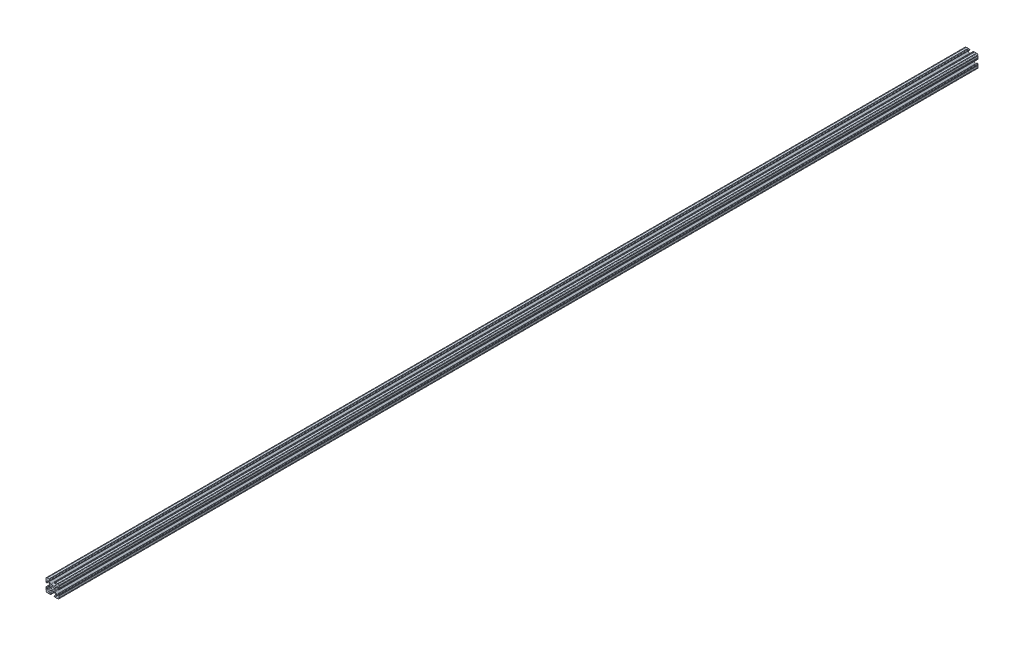
from build123d import *

# Parameters (mm, degrees)
BOSS_EXTRUDE1_DEPTH     = 1524
CUT_EXTRUDE1_DEPTH      = 1525.105829659
CUT_EXTRUDE1_DEPTH_BACK = 1525.105829659
SKETCH5_R               = 0.55245
CUT_EXTRUDE2_DEPTH      = 1525.105829659
CUT_EXTRUDE2_DEPTH_BACK = 1525.105829659
SKETCH8_W               = 50.559993734
SKETCH8_H               = 1282.7


with BuildPart() as part:
    # Sketch4 → Boss-Extrude1 (new, symmetric)
    with BuildSketch(Plane.XY):
        with BuildLine():
            Line((4.190365, -12.7), (10.11729625, -12.7))
            ThreePointArc((10.11729625, -12.7), (11.943543585, -11.943543585), (12.7, -10.11729625))
            Line((12.7, -10.11729625), (12.7, -4.190365))
            ThreePointArc((12.7, -4.190365), (12.42492494, -3.52627506), (11.760835, -3.2512))
            Line((11.760835, -3.2512), (11.429365, -3.2512))
            ThreePointArc((11.429365, -3.2512), (10.76527506, -3.52627506), (10.4902, -4.190365))
            Line((10.4902, -4.190365), (10.4902, -6.348478019))
            ThreePointArc((10.4902, -6.348478019), (9.830707141, -7.335478831), (8.666460301, -7.103895736))
            Line((8.666460301, -7.103895736), (5.299899128, -3.737334563))
            ThreePointArc((5.299899128, -3.737334563), (4.817571085, -3.015479634), (4.6482, -2.16399369))
            Line((4.6482, -2.16399369), (4.6482, 0))
            Line((4.6482, 0), (2.6035, 0))
            ThreePointArc((2.6035, 0), (1.840952505, -1.840952505), (0, -2.6035))
            Line((0, -2.6035), (0, -4.6482))
            Line((0, -4.6482), (2.16399369, -4.6482))
            ThreePointArc((2.16399369, -4.6482), (3.015479634, -4.817571085), (3.737334563, -5.299899128))
            Line((3.737334563, -5.299899128), (7.103895736, -8.666460301))
            ThreePointArc((7.103895736, -8.666460301), (7.335478831, -9.830707141), (6.348478019, -10.4902))
            Line((6.348478019, -10.4902), (4.190365, -10.4902))
            ThreePointArc((4.190365, -10.4902), (3.52627506, -10.76527506), (3.2512, -11.429365))
            Line((3.2512, -11.429365), (3.2512, -11.760835))
            ThreePointArc((3.2512, -11.760835), (3.52627506, -12.42492494), (4.190365, -12.7))
        make_face()
    extrude(amount=BOSS_EXTRUDE1_DEPTH, both=True)

    # Sketch5 → Cut-Extrude1 (cut, two sides: drawn at the far end of the back side and taken through both)
    with BuildSketch(Plane.XY.offset(-CUT_EXTRUDE1_DEPTH_BACK)):
        with Locations((10.356153152, -12.7)):
            Circle(SKETCH5_R)
        with Locations((5.796028019, -12.7)):
            Circle(SKETCH5_R)
        with Locations((12.7, -10.356153152)):
            Circle(SKETCH5_R)
        with Locations((12.7, -5.796028019)):
            Circle(SKETCH5_R)
    extrude(amount=CUT_EXTRUDE1_DEPTH + CUT_EXTRUDE1_DEPTH_BACK, mode=Mode.SUBTRACT)

    # Mirror1: part across plane


with BuildPart() as part_1:
    add(part.part)
    add(part.part.mirror(Plane(origin=(0, 0, 0), x_dir=(0, 0, 1), z_dir=(1, 0, 0))))

    # Mirror2: part across plane


with BuildPart() as part_2:
    add(part_1.part)
    add(part_1.part.mirror(Plane.ZX))

    # Sketch8 → Cut-Extrude2 (cut, two sides: drawn at the far end of the back side and taken through both)
    with BuildSketch(Plane(origin=(0, 0, 0), x_dir=(1, 0, 0), z_dir=(0, 1, 0)).offset(-CUT_EXTRUDE2_DEPTH_BACK)):
        with Locations((0, 895.35)):
            Rectangle(SKETCH8_W, SKETCH8_H)
    extrude(amount=CUT_EXTRUDE2_DEPTH + CUT_EXTRUDE2_DEPTH_BACK, mode=Mode.SUBTRACT)


solid = part_2.part
